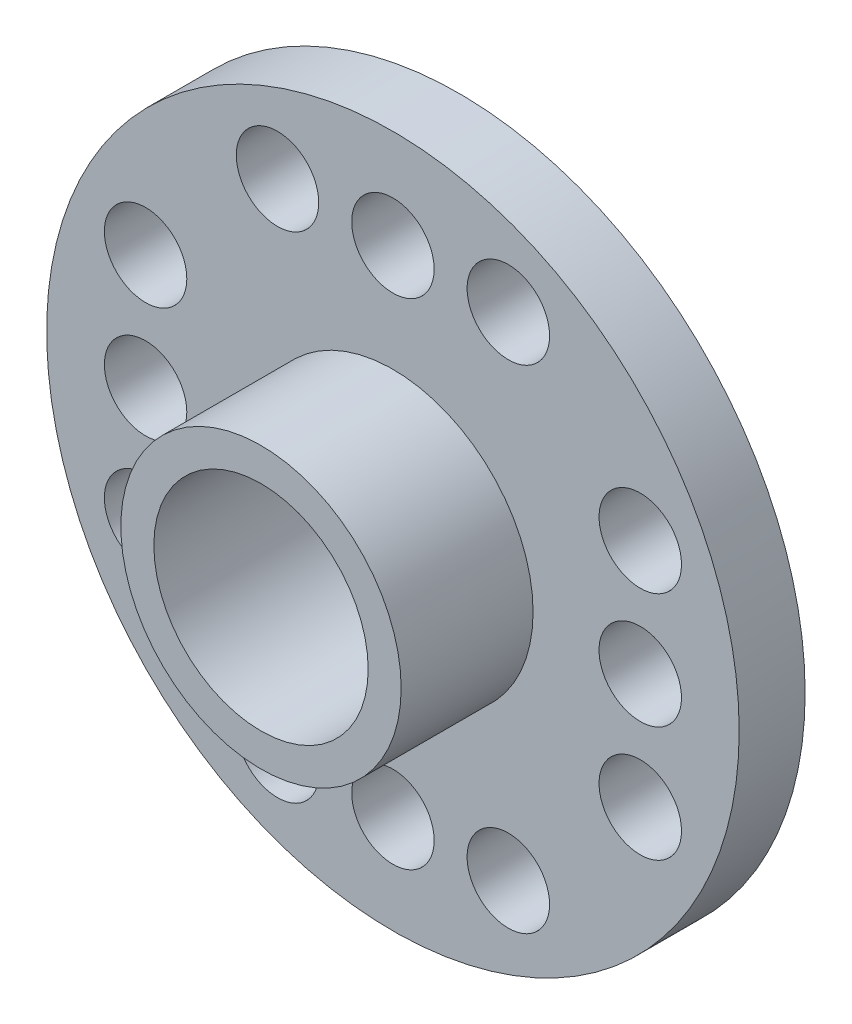
from build123d import *

# Parameters (mm, degrees)
SKETCH5_R           = 10.5
SKETCH5_R_2         = 1.25
BOSS_EXTRUDE2_DEPTH = 2
SKETCH6_R           = 1.25
CUT_EXTRUDE2_DEPTH  = 2
SKETCH7_R           = 3
CUT_EXTRUDE3_DEPTH  = 1
SKETCH9_R           = 3
CUT_EXTRUDE5_DEPTH  = 5
SKETCH10_R          = 3
BOSS_EXTRUDE5_DEPTH = 2
SKETCH11_R          = 3.25
CUT_EXTRUDE6_DEPTH  = 2
SKETCH13_R          = 4.25
SKETCH13_R_2        = 3.25
BOSS_EXTRUDE6_DEPTH = 4


with BuildPart() as part:
    # Sketch5 → Boss-Extrude2 (new body)
    with BuildSketch(Plane.XY):
        Circle(SKETCH5_R)
        with Locations((0, 7.5)):
            Circle(SKETCH5_R_2, mode=Mode.SUBTRACT)
        with Locations((-3.5, 7.5)):
            Circle(SKETCH5_R_2, mode=Mode.SUBTRACT)
        with Locations((3.5, 7.5)):
            Circle(SKETCH5_R_2, mode=Mode.SUBTRACT)
        with Locations((-7.5, 0)):
            Circle(SKETCH5_R_2, mode=Mode.SUBTRACT)
        with Locations((-7.5, 3.5)):
            Circle(SKETCH5_R_2, mode=Mode.SUBTRACT)
        with Locations((-7.5, -3.5)):
            Circle(SKETCH5_R_2, mode=Mode.SUBTRACT)
        with Locations((0, -7.5)):
            Circle(SKETCH5_R_2, mode=Mode.SUBTRACT)
        with Locations((-3.5, -7.5)):
            Circle(SKETCH5_R_2, mode=Mode.SUBTRACT)
        with Locations((3.499264905, -7.428270452)):
            Circle(SKETCH5_R_2, mode=Mode.SUBTRACT)
        with Locations((7.5, 0)):
            Circle(SKETCH5_R_2, mode=Mode.SUBTRACT)
        with Locations((7.5, 3.5)):
            Circle(SKETCH5_R_2, mode=Mode.SUBTRACT)
        with Locations((7.5, -3.5)):
            Circle(SKETCH5_R_2, mode=Mode.SUBTRACT)
    extrude(amount=BOSS_EXTRUDE2_DEPTH)

    # Sketch6 → Cut-Extrude2 (cut)
    with BuildSketch(Plane(origin=(0, 0, 0), x_dir=(-1, 0, 0), z_dir=(0, 0, -1))):
        Circle(SKETCH6_R)
    extrude(amount=-CUT_EXTRUDE2_DEPTH, mode=Mode.SUBTRACT)

    # Sketch7 → Cut-Extrude3 (cut)
    with BuildSketch(Plane(origin=(0, 0, 0), x_dir=(-1, 0, 0), z_dir=(0, 0, -1))):
        Circle(SKETCH7_R)
    extrude(amount=-CUT_EXTRUDE3_DEPTH, mode=Mode.SUBTRACT)

    # Sketch9 → Cut-Extrude5 (cut)
    with BuildSketch(Plane(origin=(0, 0, 0), x_dir=(-1, 0, 0), z_dir=(0, 0, -1))):
        Circle(SKETCH9_R)
    extrude(amount=-CUT_EXTRUDE5_DEPTH, mode=Mode.SUBTRACT)

    # Sketch10 → Boss-Extrude5 (add)
    with BuildSketch(Plane(origin=(0, 0, 0), x_dir=(-1, 0, 0), z_dir=(0, 0, -1))):
        Circle(SKETCH10_R)
    extrude(amount=-BOSS_EXTRUDE5_DEPTH)

    # Sketch11 → Cut-Extrude6 (cut)
    with BuildSketch(Plane(origin=(0, 0, 0), x_dir=(-1, 0, 0), z_dir=(0, 0, -1))):
        Circle(SKETCH11_R)
    extrude(amount=-CUT_EXTRUDE6_DEPTH, mode=Mode.SUBTRACT)

    # Sketch13 → Boss-Extrude6 (add)
    with BuildSketch(Plane.XY.offset(2)):
        Circle(SKETCH13_R)
        with Locations(Location((0, 0, 0), (0, 0, 180))):
            Circle(SKETCH13_R_2, mode=Mode.SUBTRACT)
    extrude(amount=BOSS_EXTRUDE6_DEPTH)


solid = part.part
